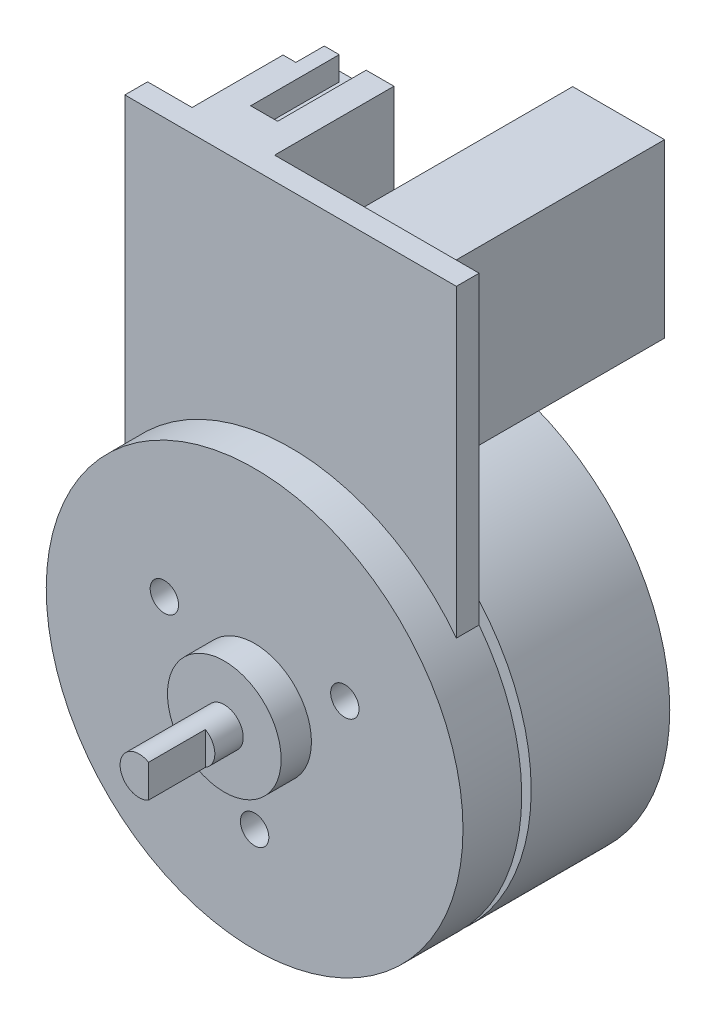
from build123d import *
from build123d.topology import SkipClean

# Parameters (mm, degrees)
SKETCH1_R           = 22
BOSS_EXTRUDE1_DEPTH = 21.83
SKETCH2_R           = 6
SKETCH2_R_2         = 2
BOSS_EXTRUDE2_DEPTH = 3.2
SKETCH3_R           = 2
BOSS_EXTRUDE3_DEPTH = 12.2
BOSS_EXTRUDE4_START = -6.2
BOSS_EXTRUDE4_DEPTH = 6.2
CUT_EXTRUDE3_START  = -3.8
CUT_EXTRUDE3_DEPTH  = 3.8
SKETCH7_W           = 9.7
SKETCH7_H           = 18.15
BOSS_EXTRUDE5_DEPTH = 26.4
SKETCH7_3_W         = 8.71
SKETCH7_3_H         = 22
BOSS_EXTRUDE6_DEPTH = 15
SKETCH8_R           = 1.5
CUT_EXTRUDE4_DEPTH  = 5
SKETCH9_W           = 1
SKETCH9_H           = 3.350814255
SKETCH10_W          = 6
SKETCH10_H          = 17
BOSS_EXTRUDE7_DEPTH = 1
SKETCH12_W          = 1.355
SKETCH12_H          = 22
CUT_EXTRUDE5_DEPTH  = 3
SKETCH13_W          = 2.841503492
SKETCH13_H          = 2.5
CUT_EXTRUDE6_DEPTH  = 9.35
CUT_EXTRUDE7_START  = -6
CUT_EXTRUDE7_DEPTH  = 6


with BuildPart() as part:
    # Sketch1 → Boss-Extrude1 (new body)
    with BuildSketch(Plane.XY):
        Circle(SKETCH1_R)
    extrude(amount=BOSS_EXTRUDE1_DEPTH)

    # Sketch2 → Boss-Extrude2 (add)
    with BuildSketch(Plane.XY.offset(21.83)):
        Circle(SKETCH2_R)
        Circle(SKETCH2_R_2, mode=Mode.SUBTRACT)
    extrude(amount=BOSS_EXTRUDE2_DEPTH)

    # Sketch3 → Boss-Extrude3 (add)
    with BuildSketch(Plane.XY.offset(21.83)):
        Circle(SKETCH3_R)
    extrude(amount=BOSS_EXTRUDE3_DEPTH)

    # Sketch4 → Boss-Extrude4 (add)
    with BuildSketch(Plane.XY.offset(21.83).offset(BOSS_EXTRUDE4_START)):
        with BuildLine():
            ThreePointArc((-17.5, 13.332291626), (0, 22), (17.5, 13.332291626))
            Line((17.5, 13.332291626), (17.5, 45.5))
            Line((17.5, 45.5), (-17.5, 45.5))
            Line((-17.5, 45.5), (-17.5, 13.332291626))
        make_face()
    extrude(amount=BOSS_EXTRUDE4_DEPTH)

    # Sketch4<4> → Cut-Extrude3 (cut)
    with SkipClean():  # the faces are left unmerged after this step: merging them gives an invalid solid
        with BuildSketch(Plane.XY.offset(21.83).offset(CUT_EXTRUDE3_START)):
            with BuildLine():
                ThreePointArc((-17.5, 13.332291626), (0, 22), (17.5, 13.332291626))
                Line((17.5, 13.332291626), (17.5, 45.5))
                Line((17.5, 45.5), (-17.5, 45.5))
                Line((-17.5, 45.5), (-17.5, 13.332291626))
            make_face()
        extrude(amount=CUT_EXTRUDE3_DEPTH, mode=Mode.SUBTRACT)

    # Sketch7 → Boss-Extrude5 (add)
    with SkipClean():  # the faces are left unmerged after this step: merging them gives an invalid solid
        with BuildSketch(Plane.XY.offset(18.03)):
            with Locations((8.23, 34.425)):
                Rectangle(SKETCH7_W, SKETCH7_H)
        extrude(amount=-BOSS_EXTRUDE5_DEPTH)

    # Sketch7<3> → Boss-Extrude6 (add)
    with SkipClean():  # the faces are left unmerged after this step: merging them gives an invalid solid
        with BuildSketch(Plane.XY.offset(18.03)):
            with Locations((-8.445, 34.5)):
                Rectangle(SKETCH7_3_W, SKETCH7_3_H)
        extrude(amount=-BOSS_EXTRUDE6_DEPTH)

    # Sketch8 → Cut-Extrude4 (cut)
    with SkipClean():  # the faces are left unmerged after this step: merging them gives an invalid solid
        with BuildSketch(Plane.XY.offset(21.83)):
            with Locations((-9.526279442, 5.5)):
                Circle(SKETCH8_R)
            with Locations((9.526279442, 5.5)):
                Circle(SKETCH8_R)
            with Locations((0, -11)):
                Circle(SKETCH8_R)
        extrude(amount=-CUT_EXTRUDE4_DEPTH, mode=Mode.SUBTRACT)

    # Sketch9 → Cut-Revolve1 (revolve, cut)
    with SkipClean():  # the faces are left unmerged after this step: merging them gives an invalid solid
        with BuildSketch(Plane(origin=(0, 0, 0), x_dir=(0, 0, -1), z_dir=(1, 0, 0))):
            with Locations((-15.13, 20.324592872)):
                Rectangle(SKETCH9_W, SKETCH9_H)
        revolve(axis=Axis((0, 0, 34.03), (0, 0, -1)), mode=Mode.SUBTRACT)

    # Sketch10 → Boss-Extrude7 (add)
    with SkipClean():  # the faces are left unmerged after this step: merging them gives an invalid solid
        with BuildSketch(Plane(origin=(0, 0, 3.03), x_dir=(-1, 0, 0), z_dir=(0, 0, -1))):
            with Locations((8.445, 34.5)):
                Rectangle(SKETCH10_W, SKETCH10_H)
        extrude(amount=BOSS_EXTRUDE7_DEPTH)

    # Sketch12 → Cut-Extrude5 (cut)
    with SkipClean():  # the faces are left unmerged after this step: merging them gives an invalid solid
        with BuildSketch(Plane(origin=(0, 0, 3.03), x_dir=(-1, 0, 0), z_dir=(0, 0, -1))):
            with Locations((12.1225, 34.5)):
                Rectangle(SKETCH12_W, SKETCH12_H)
        extrude(amount=-CUT_EXTRUDE5_DEPTH, mode=Mode.SUBTRACT)

    # Sketch13 → Cut-Extrude6 (cut)
    with SkipClean():  # the faces are left unmerged after this step: merging them gives an invalid solid
        with BuildSketch(Plane(origin=(0, 0, 3.03), x_dir=(-1, 0, 0), z_dir=(0, 0, -1))):
            with Locations((8.445, 44.25)):
                Rectangle(SKETCH13_W, SKETCH13_H)
            with Locations((8.445, 24.75)):
                Rectangle(SKETCH13_W, SKETCH13_H)
        extrude(amount=-CUT_EXTRUDE6_DEPTH, mode=Mode.SUBTRACT)

    # Sketch14 → Cut-Extrude7 (cut)
    with SkipClean():  # the faces are left unmerged after this step: merging them gives an invalid solid
        with BuildSketch(Plane.XY.offset(34.03).offset(CUT_EXTRUDE7_START)):
            with BuildLine():
                Line((1, 1.732050808), (1, -1.732050808))
                ThreePointArc((1, -1.732050808), (2, 0), (1, 1.732050808))
            make_face()
        extrude(amount=CUT_EXTRUDE7_DEPTH, mode=Mode.SUBTRACT)


solid = part.part
